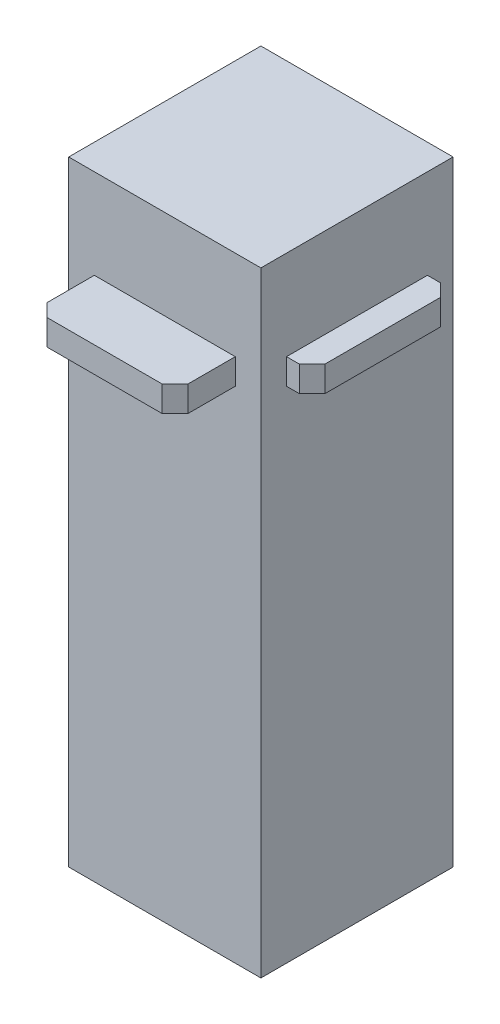
from build123d import *

# Parameters (mm, degrees)
SKETCH2_W            = 150
SKETCH2_H            = 150
SKETCH2_W_2          = 130
SKETCH2_H_2          = 130
BOSS_EXTRUDE2_DEPTH  = 450
SKETCH4_W            = 150
SKETCH4_H            = 150
BOSS_EXTRUDE3_DEPTH  = 15
BOSS_EXTRUDE4_START  = -450
SKETCH4_2_W          = 150
SKETCH4_2_H          = 150
BOSS_EXTRUDE4_DEPTH  = 15
SKETCH5_R            = 30
CUT_EXTRUDE1_DEPTH   = 15
SKETCH7_W            = 20
SKETCH7_H            = 10
BOSS_EXTRUDE5_DEPTH  = 50
BOSS_EXTRUDE6_START  = -10
SKETCH9_R            = 25
BOSS_EXTRUDE6_DEPTH  = 20
CUT_EXTRUDE3_START   = 5
SKETCH10_R           = 25
SKETCH10_R_2         = 22
CUT_EXTRUDE3_DEPTH   = 10
SKETCH12_W           = 20
SKETCH12_H           = 40
BOSS_EXTRUDE7_DEPTH  = 25
SKETCH13_R           = 4
BOSS_EXTRUDE8_DEPTH  = 23
SKETCH18_W           = 110
SKETCH18_H           = 20
BOSS_EXTRUDE11_DEPTH = 20
CHAMFER1_SIZE        = 10
CHAMFER2_SIZE        = 10
SKETCH19_W           = 110
SKETCH19_H           = 20
BOSS_EXTRUDE12_DEPTH = 47
CHAMFER3_SIZE        = 10


with BuildPart() as part:
    # Sketch2 → Boss-Extrude2 (new body)
    with BuildSketch(Plane(origin=(0, 0, 0), x_dir=(1, 0, 0), z_dir=(0, 1, 0))):
        Rectangle(SKETCH2_W, SKETCH2_H)
        Rectangle(SKETCH2_W_2, SKETCH2_H_2, mode=Mode.SUBTRACT)
    extrude(amount=BOSS_EXTRUDE2_DEPTH)

    # Sketch4 → Boss-Extrude3 (add)
    with BuildSketch(Plane(origin=(0, 450, 0), x_dir=(1, 0, 0), z_dir=(0, 1, 0))):
        Rectangle(SKETCH4_W, SKETCH4_H)
    extrude(amount=BOSS_EXTRUDE3_DEPTH)

    # Sketch4<2> → Boss-Extrude4 (add)
    with BuildSketch(Plane(origin=(0, 450, 0), x_dir=(1, 0, 0), z_dir=(0, 1, 0)).offset(BOSS_EXTRUDE4_START)):
        Rectangle(SKETCH4_2_W, SKETCH4_2_H)
    extrude(amount=-BOSS_EXTRUDE4_DEPTH)

    # Sketch5 → Cut-Extrude1 (cut)
    with BuildSketch(Plane.XZ.offset(15)):
        with Locations((-35, 0)):
            Circle(SKETCH5_R)
    extrude(amount=-CUT_EXTRUDE1_DEPTH, mode=Mode.SUBTRACT)

    # Sketch7 → Boss-Extrude5 (add)
    with BuildSketch(Plane.XZ.offset(-450)):
        with Locations((0, -15)):
            Rectangle(SKETCH7_W, SKETCH7_H)
    boss_extrude5 = extrude(amount=BOSS_EXTRUDE5_DEPTH)

    # Mirror1: Boss-Extrude5 across plane
    add(boss_extrude5.mirror(Plane.XY))

    # Sketch9 → Boss-Extrude6 (add)
    with BuildSketch(Plane.XY.offset(BOSS_EXTRUDE6_START)):
        with Locations((0, 420)):
            Circle(SKETCH9_R)
    extrude(amount=BOSS_EXTRUDE6_DEPTH)

    # Sketch10 → Cut-Extrude3 (cut)
    with BuildSketch(Plane.XY.offset(-10).offset(CUT_EXTRUDE3_START)):
        with Locations((0, 420)):
            Circle(SKETCH10_R)
        with Locations((0, 420)):
            Circle(SKETCH10_R_2, mode=Mode.SUBTRACT)
    extrude(amount=CUT_EXTRUDE3_DEPTH, mode=Mode.SUBTRACT)

    # Sketch12 → Boss-Extrude7 (add)
    with BuildSketch(Plane(origin=(0, 0, 0), x_dir=(1, 0, 0), z_dir=(0, 1, 0))):
        with Locations((35, 43)):
            Rectangle(SKETCH12_W, SKETCH12_H)
    extrude(amount=BOSS_EXTRUDE7_DEPTH)

    # Sketch13 → Boss-Extrude8 (add)
    with BuildSketch(Plane.XY.offset(-23)):
        with Locations((35.121485498, 12.610702381)):
            Circle(SKETCH13_R)
    extrude(amount=BOSS_EXTRUDE8_DEPTH)

    # Sketch18 → Boss-Extrude11 (add)
    with BuildSketch(Plane(origin=(75, 0, 0), x_dir=(0, 0, -1), z_dir=(1, 0, 0))):
        with Locations((0, 385)):
            Rectangle(SKETCH18_W, SKETCH18_H)
    extrude(amount=BOSS_EXTRUDE11_DEPTH)

    # Chamfer1
    chamfer1_edges = [part.edges().sort_by_distance(p)[0] for p in [
        (95, 385, 55),
    ]]
    chamfer(chamfer1_edges, length=CHAMFER1_SIZE)

    # Chamfer2
    chamfer2_edges = [part.edges().sort_by_distance(p)[0] for p in [
        (95, 385, -55),
    ]]
    chamfer(chamfer2_edges, length=CHAMFER2_SIZE)

    # Sketch19 → Boss-Extrude12 (add)
    with BuildSketch(Plane.XY.offset(75)):
        with Locations((0, 385)):
            Rectangle(SKETCH19_W, SKETCH19_H)
    extrude(amount=BOSS_EXTRUDE12_DEPTH)

    # Chamfer3
    chamfer3_edges = [part.edges().sort_by_distance(p)[0] for p in [
        (-55, 385, 122),
        (55, 385, 122),
    ]]
    chamfer(chamfer3_edges, length=CHAMFER3_SIZE)


solid = part.part
